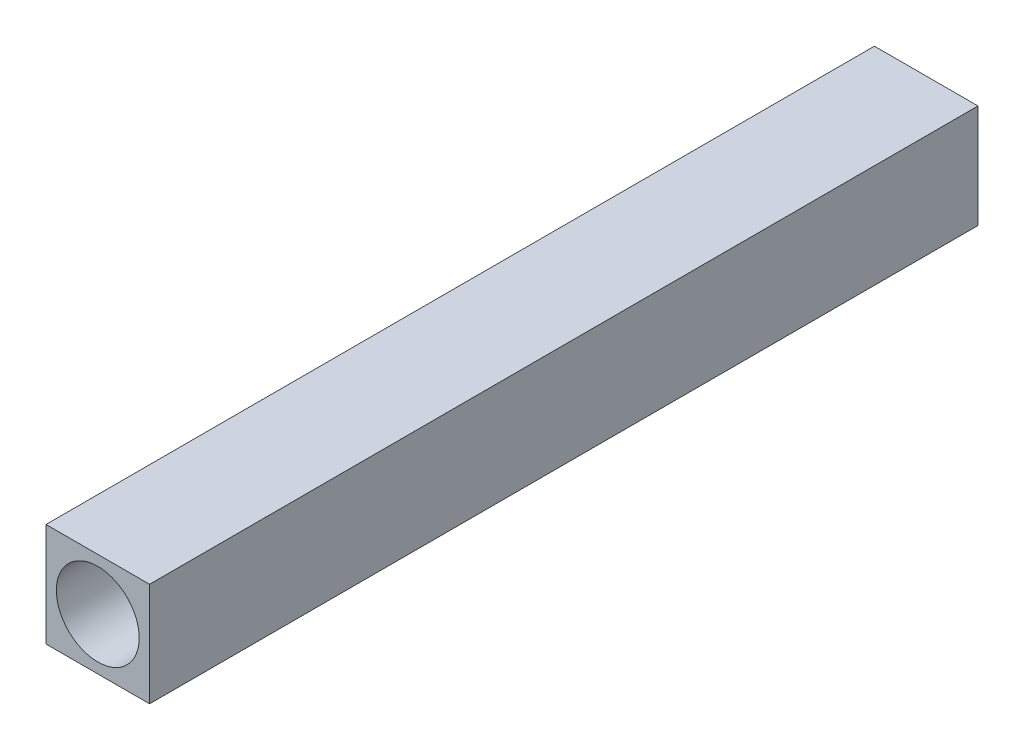
from build123d import *

# Parameters (mm, degrees)
SKETCH1_W           = 25
SKETCH1_H           = 25
SKETCH1_R           = 10
BOSS_EXTRUDE1_DEPTH = 100


with BuildPart() as part:
    # Sketch1 → Boss-Extrude1 (new, symmetric)
    with BuildSketch(Plane.XY):
        Rectangle(SKETCH1_W, SKETCH1_H)
        Circle(SKETCH1_R, mode=Mode.SUBTRACT)
    extrude(amount=BOSS_EXTRUDE1_DEPTH, both=True)


solid = part.part
